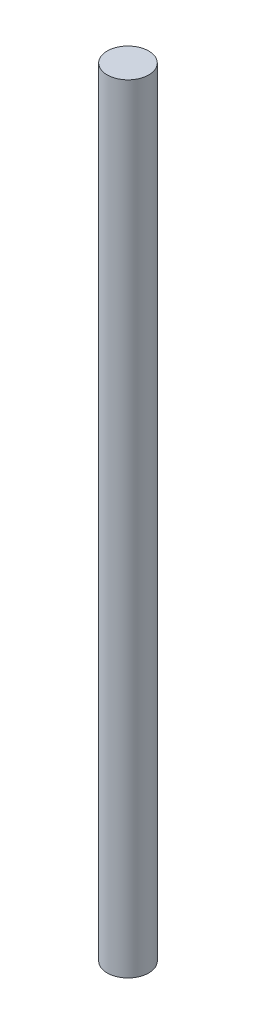
from build123d import *

# Parameters (mm, degrees)
SKETCH1_R           = 8
BOSS_EXTRUDE1_DEPTH = 300


with BuildPart() as part:
    # Sketch1 → Boss-Extrude1 (new body)
    with BuildSketch(Plane(origin=(0, 0, 0), x_dir=(1, 0, 0), z_dir=(0, 1, 0))):
        with Locations(Location((0, 0, 0), (0, 0, 270))):
            Circle(SKETCH1_R)
    extrude(amount=BOSS_EXTRUDE1_DEPTH)


solid = part.part
